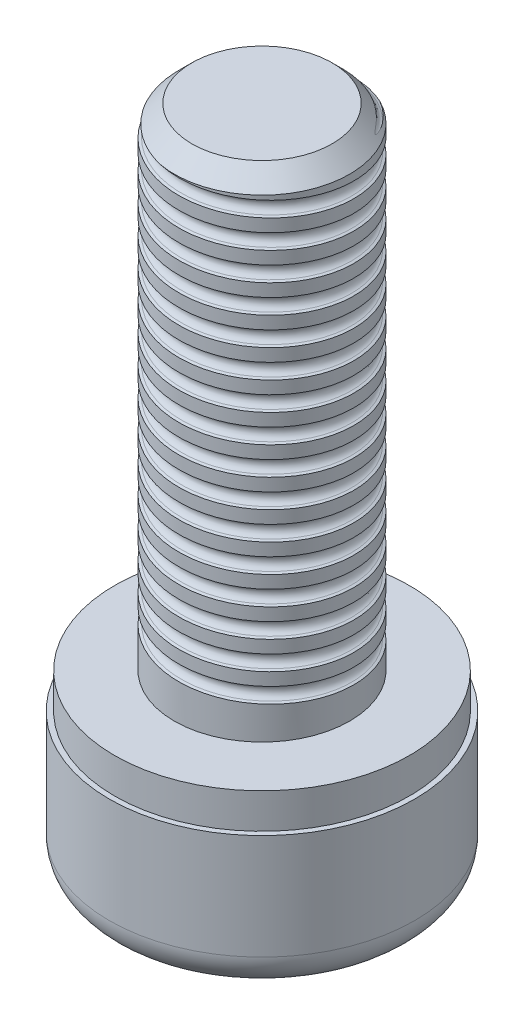
from build123d import *

# Parameters (mm, degrees)
SKETCH_1_R          = 4.35
EXTRUDE_1_DEPTH     = 5
SKETCH_2_R          = 2.5
EXTRUDE_2_DEPTH     = 14
CHAMFER_1_SIZE      = 0.5
CUT_EXTRUDE_1_DEPTH = 2.5
FILLET_1_R          = 1
CUT_EXTRUDE_START   = -1
SKETCH_4_R          = 4.35
SKETCH_4_R_2        = 4.2
CUT_EXTRUDE_3_DEPTH = 1
SWEEP_1_PITCH       = 0.8
SWEEP_1_HEIGHT      = 13.2
SWEEP_1_RADIUS      = 2.5
SWEEP_1_START_ANGLE = 90


with BuildPart() as part:
    # Эскиз1 → Бобышка-Вытянуть1 (new body)
    with BuildSketch(Plane(origin=(0, 0, 0), x_dir=(1, 0, 0), z_dir=(0, 1, 0))):
        with Locations(Location((0, 0, 0), (0, 0, 270))):
            Circle(SKETCH_1_R)
    extrude(amount=EXTRUDE_1_DEPTH)

    # Эскиз2 → Бобышка-Вытянуть2 (add)
    with BuildSketch(Plane(origin=(0, 5, 0), x_dir=(1, 0, 0), z_dir=(0, 1, 0))):
        with Locations(Location((0, 0, 0), (0, 0, 270))):
            Circle(SKETCH_2_R)
    extrude(amount=EXTRUDE_2_DEPTH)

    # Фаска1
    chamfer_1_edges = [part.edges().sort_by_distance(p)[0] for p in [
        (0, 19, -2.5),
    ]]
    chamfer(chamfer_1_edges, length=CHAMFER_1_SIZE)

    # Эскиз3 → Вырез-Вытянуть1 (cut)
    with BuildSketch(Plane.XZ):
        Polygon((1.989239345, -1.173141152), (2.010589712, 1.136161231), (0.021350368, 2.309302383), (-1.989239345, 1.173141152), (-2.010589712, -1.136161231), (-0.021350368, -2.309302383), align=None)
    extrude(amount=-CUT_EXTRUDE_1_DEPTH, mode=Mode.SUBTRACT)

    # Скругление1
    fillet_1_edges = [part.edges().sort_by_distance(p)[0] for p in [
        (0, 0, -4.35),
    ]]
    fillet(fillet_1_edges, radius=FILLET_1_R)

    # Эскиз4 → Вырез-Вытянуть3 (cut)
    with BuildSketch(Plane(origin=(0, 5, 0), x_dir=(1, 0, 0), z_dir=(0, 1, 0)).offset(CUT_EXTRUDE_START)):
        with Locations(Location((0, 0, 0), (0, 0, 270))):
            Circle(SKETCH_4_R)
        with Locations(Location((0, 0, 0), (0, 0, 270))):
            Circle(SKETCH_4_R_2, mode=Mode.SUBTRACT)
    extrude(amount=CUT_EXTRUDE_3_DEPTH, mode=Mode.SUBTRACT)

    # Вырез-По траектории1: sweep along a helix
    with BuildLine() as sweep_1_path:
        add(Helix(SWEEP_1_PITCH, SWEEP_1_HEIGHT, SWEEP_1_RADIUS, center=(0, 18.5, 0), direction=(0, -1, 0), lefthand=True, mode=Mode.PRIVATE).rotate(Axis((0, 18.5, 0), (0, -1, 0)), SWEEP_1_START_ANGLE))
    # Эскиз10 → Вырез-По траектории1 (sweep, cut)
    with BuildSketch(Plane.XY):
        with BuildLine():
            Line((2.9, 16.822824197), (2.9, 16.094883729))
            Line((2.9, 16.094883729), (2.429813333, 16.26601768))
            ThreePointArc((2.429813333, 16.26601768), (2.294787914, 16.458853963), (2.429813333, 16.651690246))
            Line((2.429813333, 16.651690246), (2.9, 16.822824197))
        make_face()
    sweep(path=sweep_1_path.line, is_frenet=True, mode=Mode.SUBTRACT)


solid = part.part
